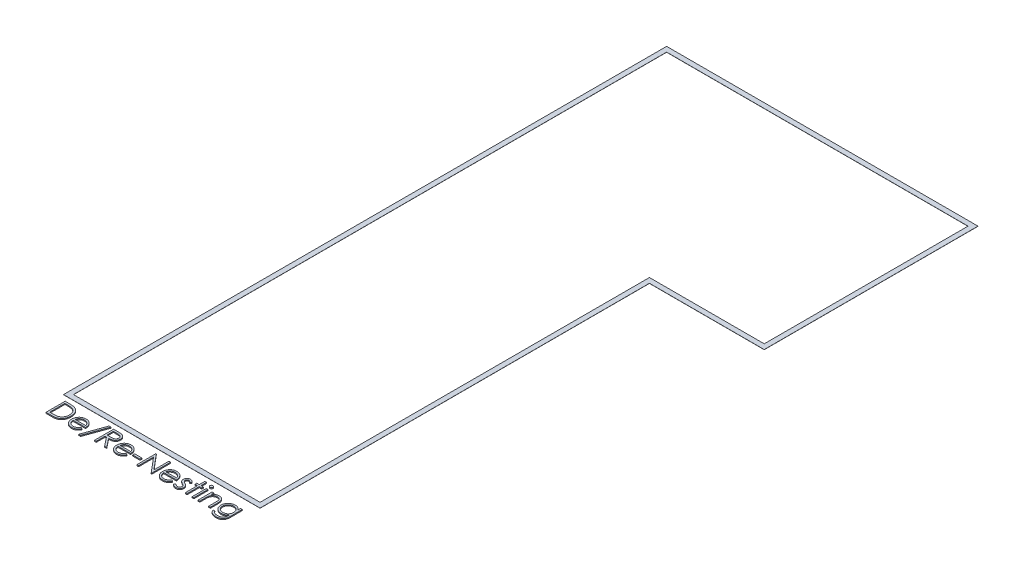
from build123d import *

# Parameters (mm, degrees)
BOSS_EXTRUDE1_DEPTH    = 0.3
BOSS_EXTRUDE2_DEPTH    = 2
BOSS_EXTRUDE2_2_DEPTH  = 2
BOSS_EXTRUDE2_3_DEPTH  = 2
BOSS_EXTRUDE2_4_DEPTH  = 2
BOSS_EXTRUDE2_5_DEPTH  = 2
SKETCH2_W              = 14.807692308
SKETCH2_H              = 3.948717949
BOSS_EXTRUDE2_6_DEPTH  = 2
BOSS_EXTRUDE2_7_DEPTH  = 2
BOSS_EXTRUDE2_8_DEPTH  = 2
BOSS_EXTRUDE2_9_DEPTH  = 2
BOSS_EXTRUDE2_10_DEPTH = 2
BOSS_EXTRUDE2_11_DEPTH = 2
SKETCH2_W_2            = 3.455128205
SKETCH2_H_2            = 28.134615384
BOSS_EXTRUDE2_12_DEPTH = 2
BOSS_EXTRUDE2_13_DEPTH = 2
BOSS_EXTRUDE2_14_DEPTH = 2


with BuildPart() as part:
    # Sketch1 → Boss-Extrude1 (new body)
    with BuildSketch(Plane(origin=(0, 0, 0), x_dir=(1, 0, 0), z_dir=(0, 1, 0))):
        Polygon((-312.025477323, 605.165510167), (-312.025477323, -604.834489833), (82.380342564, -604.834489833), (82.380342564, 176.302523591), (312.68751799, 176.302523591), (312.68751799, 605.165510167), align=None)
        Polygon((-302.025477323, 595.165510167), (-302.025477323, -594.834489833), (72.380342564, -594.834489833), (72.380342564, 186.302523591), (302.68751799, 186.302523591), (302.68751799, 595.165510167), align=None, mode=Mode.SUBTRACT)
    extrude(amount=BOSS_EXTRUDE1_DEPTH)


with BuildPart() as body_2:
    # Sketch2 → Boss-Extrude2 (new body)
    with BuildSketch(Plane(origin=(0, 0, 0), x_dir=(1, 0, 0), z_dir=(0, 1, 0))):
        with BuildLine():
            Line((-297.089579887, -654.834489833), (-297.089579887, -616.334489833))
            Line((-297.089579887, -616.334489833), (-289.315541426, -616.334489833))
            add(Edge.make_bspline(
                [(-289.315541426, -616.334489833), (-288.639382556, -616.339358103), (-287.333047137, -616.348763576), (-285.445310215, -616.408398878), (-283.698688828, -616.513894002), (-282.098927378, -616.66755879), (-280.641634046, -616.85624216), (-279.330889357, -617.092746608), (-278.159915785, -617.372016482), (-277.439751939, -617.610116434), (-277.099195272, -617.722710987)],
                knots=[0, 0, 0, 0, 1.314313732, 2.53924729, 3.670748893, 4.714932338, 5.66265055, 6.526160246, 7.303039223, 8, 8, 8, 8], degree=3))
            add(Edge.make_bspline(
                [(-277.099195272, -617.722710987), (-276.65375314, -617.892448749), (-275.772970024, -618.228075184), (-274.518891676, -618.861194499), (-273.338312684, -619.578538618), (-272.22490209, -620.381053108), (-271.204093, -621.291460941), (-270.236006135, -622.271088883), (-269.360244174, -623.355560625), (-268.558252917, -624.522385493), (-267.835160663, -625.757818067), (-267.206629927, -627.059504263), (-266.684636, -628.420833552), (-266.251310508, -629.83802018), (-265.909799475, -631.314180336), (-265.676798226, -632.851032862), (-265.523117337, -634.442503946), (-265.507672773, -635.522423047), (-265.499836298, -636.070367237)],
                knots=[0, 0, 0, 0, 0.984719456, 1.947108742, 2.898477687, 3.838006223, 4.779231079, 5.722358779, 6.681677486, 7.655904652, 8.64651281, 9.637519902, 10.640069247, 11.656948941, 12.698408672, 13.768548281, 14.867775369, 16, 16, 16, 16], degree=3))
            add(Edge.make_bspline(
                [(-265.499836298, -636.070367237), (-265.50675494, -636.546240861), (-265.520388847, -637.483999539), (-265.642811322, -638.866049391), (-265.820750842, -640.207098675), (-266.096237018, -641.500761376), (-266.430664666, -642.758371773), (-266.85927033, -643.96652646), (-267.350260788, -645.136308363), (-267.922809453, -646.251900598), (-268.551364688, -647.308817694), (-269.225903863, -648.305148503), (-269.945707512, -649.226675943), (-270.717639474, -650.076190675), (-271.531724355, -650.852412038), (-272.393291991, -651.561824207), (-273.30456555, -652.19054631), (-274.2614635, -652.7632845), (-275.291900921, -653.262908411), (-276.415395449, -653.685638519), (-277.636738407, -654.035951288), (-278.952931933, -654.328231142), (-280.366250189, -654.560081471), (-281.878078813, -654.715471788), (-283.486094999, -654.820554047), (-284.590266917, -654.829754374), (-285.158590304, -654.834489833)],
                knots=[0, 0, 0, 0, 1.105936401, 2.179363191, 3.223086493, 4.248585256, 5.251745608, 6.245858792, 7.225916811, 8.198733463, 9.158002045, 10.082870192, 10.993790845, 11.873723703, 12.748670949, 13.606408763, 14.465103618, 15.319838547, 16.196477973, 17.123216899, 18.106603292, 19.147568657, 20.255746949, 21.433717677, 22.679120308, 24, 24, 24, 24], degree=3))
            Line((-285.158590304, -654.834489833), (-297.089579887, -654.834489833))
        make_face()
        with BuildLine():
            Line((-293.634451682, -650.885771885), (-289.215281009, -650.885771885))
            add(Edge.make_bspline(
                [(-289.215281009, -650.885771885), (-288.580268931, -650.883042825), (-287.358908148, -650.877793842), (-285.602670178, -650.831734608), (-283.997996817, -650.756473295), (-282.544660214, -650.65114744), (-281.243480947, -650.511792673), (-280.091739698, -650.356418742), (-279.093211856, -650.162846784), (-278.48898805, -649.98738623), (-278.209772195, -649.906304737)],
                knots=[0, 0, 0, 0, 1.375205317, 2.645023457, 3.804390687, 4.853969522, 5.800190428, 6.637939096, 7.370582563, 8, 8, 8, 8], degree=3))
            add(Edge.make_bspline(
                [(-278.209772195, -649.906304737), (-277.858340212, -649.782537597), (-277.163870192, -649.537959491), (-276.164178255, -649.091825218), (-275.231851204, -648.56336245), (-274.350640926, -647.975937437), (-273.533047716, -647.308831414), (-272.769382436, -646.576550538), (-272.061182621, -645.775368012), (-271.415765234, -644.906278235), (-270.838173889, -643.974690483), (-270.337990366, -642.989763312), (-269.899623518, -641.9622884), (-269.555558999, -640.876487655), (-269.285887574, -639.742068012), (-269.094876006, -638.558949666), (-268.975914037, -637.327353566), (-268.96203811, -636.489680199), (-268.954964503, -636.062654897)],
                knots=[0, 0, 0, 0, 0.998632004, 1.973411704, 2.929992603, 3.868527914, 4.809262121, 5.754881198, 6.702106254, 7.672490631, 8.653608572, 9.636854334, 10.631411391, 11.644891563, 12.686317036, 13.754757253, 14.855430412, 16, 16, 16, 16], degree=3))
            add(Edge.make_bspline(
                [(-268.954964503, -636.062654897), (-268.960610664, -635.612386614), (-268.971702597, -634.727830586), (-269.111120012, -633.429932938), (-269.314857122, -632.181645782), (-269.609477669, -630.982885633), (-269.984917336, -629.831313759), (-270.453458395, -628.733299147), (-270.988791207, -627.677245589), (-271.625727912, -626.687527566), (-272.323299439, -625.751503366), (-273.097456112, -624.893999294), (-273.935898536, -624.113061991), (-274.82948188, -623.396529552), (-275.803389972, -622.773229117), (-276.83468057, -622.215675625), (-277.938482953, -621.742500821), (-278.706422608, -621.49083333), (-279.096691266, -621.362935346)],
                knots=[0, 0, 0, 0, 1.122418816, 2.205001699, 3.251619955, 4.274784885, 5.280384055, 6.268708349, 7.249350384, 8.229342522, 9.199999885, 10.157847722, 11.105861043, 12.055065948, 13.010012805, 13.98527497, 14.976112212, 16, 16, 16, 16], degree=3))
            add(Edge.make_bspline(
                [(-279.096691266, -621.362935346), (-279.419553876, -621.27365464), (-280.106048369, -621.083819361), (-281.226282473, -620.876740264), (-282.487049117, -620.694090774), (-283.893945829, -620.539452342), (-285.445368879, -620.428491807), (-287.142511447, -620.345207346), (-288.986107097, -620.289034389), (-290.26411497, -620.28519861), (-290.927420432, -620.283207782)],
                knots=[0, 0, 0, 0, 0.674548936, 1.434276114, 2.292660221, 3.240891867, 4.284742987, 5.42552168, 6.663806718, 8, 8, 8, 8], degree=3))
            Line((-290.927420432, -620.283207782), (-293.634451682, -620.283207782))
            Line((-293.634451682, -620.283207782), (-293.634451682, -650.885771885))
        make_face(mode=Mode.SUBTRACT)
    extrude(amount=BOSS_EXTRUDE2_DEPTH)


with BuildPart() as body_3:
    # Sketch2 → Boss-Extrude2 2 (new body)
    with BuildSketch(Plane(origin=(0, 0, 0), x_dir=(1, 0, 0), z_dir=(0, 1, 0))):
        with BuildLine():
            Line((-235.498834695, -645.949874449), (-232.429323477, -647.561753455))
            add(Edge.make_bspline(
                [(-232.429323477, -647.561753455), (-232.673926025, -647.995630099), (-233.149825718, -648.83978223), (-233.968233945, -649.999532695), (-234.826146743, -651.04285757), (-235.762290391, -651.941883767), (-236.74865686, -652.725649001), (-237.790716062, -653.411365073), (-238.893893058, -653.995668797), (-240.05824003, -654.487946604), (-241.293535093, -654.866451039), (-242.602771773, -655.133797469), (-243.988458222, -655.299053424), (-244.938266201, -655.318249973), (-245.424615945, -655.328079577)],
                knots=[0, 0, 0, 0, 1.120438281, 2.179929193, 3.190490725, 4.156257408, 5.095198341, 6.022838206, 6.959905092, 7.901321166, 8.864066838, 9.862729781, 10.905609505, 12, 12, 12, 12], degree=3))
            add(Edge.make_bspline(
                [(-245.424615945, -655.328079577), (-245.965177698, -655.315460648), (-247.019657076, -655.290844774), (-248.554594294, -655.078627666), (-249.999767897, -654.73243172), (-251.355096634, -654.248810763), (-252.617261412, -653.617110198), (-253.788770815, -652.847555899), (-254.8757856, -651.944101097), (-255.844051901, -650.898920219), (-256.71573461, -649.780418688), (-257.48491863, -648.614903959), (-258.127950372, -647.40530849), (-258.651029084, -646.159332725), (-259.073482598, -644.884829896), (-259.36791634, -643.570203753), (-259.537643568, -642.219012327), (-259.563652469, -641.304941634), (-259.576759375, -640.844305538)],
                knots=[0, 0, 0, 0, 1.145258523, 2.234067595, 3.276747158, 4.290159414, 5.277019952, 6.260822364, 7.254936242, 8.264827045, 9.274100331, 10.257902744, 11.220704747, 12.172965371, 13.118907548, 14.062713208, 15.023725156, 16, 16, 16, 16], degree=3))
            add(Edge.make_bspline(
                [(-259.576759375, -640.844305538), (-259.56510882, -640.412062404), (-259.542018959, -639.555413592), (-259.396480298, -638.287492603), (-259.138549074, -637.055179625), (-258.784609511, -635.857450697), (-258.327545803, -634.696311223), (-257.768391391, -633.571054523), (-257.106275236, -632.482877985), (-256.595075824, -631.796443514), (-256.337576682, -631.450675731)],
                knots=[0, 0, 0, 0, 1.024358464, 2.0301432, 3.019427413, 4.004406732, 4.986367066, 5.972626655, 6.978780325, 8, 8, 8, 8], degree=3))
            add(Edge.make_bspline(
                [(-256.337576682, -631.450675731), (-255.988792172, -631.03411816), (-255.302271759, -630.214198505), (-254.14115185, -629.136876921), (-252.88384969, -628.234395394), (-251.546121803, -627.486316897), (-250.112420589, -626.91790678), (-248.602018387, -626.494323375), (-246.997716939, -626.256965254), (-245.900959509, -626.223439084), (-245.339780208, -626.206284705)],
                knots=[0, 0, 0, 0, 1.030682036, 2.02871468, 2.997146059, 3.962720338, 4.930598197, 5.918074684, 6.934738563, 8, 8, 8, 8], degree=3))
            add(Edge.make_bspline(
                [(-245.339780208, -626.206284705), (-244.76285655, -626.221179243), (-243.631063844, -626.250398931), (-241.980710513, -626.521288598), (-240.419142631, -626.950866699), (-238.946985083, -627.557558394), (-237.564088615, -628.340313464), (-236.27944207, -629.30987372), (-235.071075432, -630.43647268), (-234.368081064, -631.302867983), (-234.010353125, -631.743744641)],
                knots=[0, 0, 0, 0, 1.056321875, 2.072262726, 3.055038591, 4.01806755, 4.982017516, 5.957941055, 6.960871419, 8, 8, 8, 8], degree=3))
            add(Edge.make_bspline(
                [(-234.010353125, -631.743744641), (-233.766956803, -632.075984036), (-233.281784279, -632.738251342), (-232.674066179, -633.81813407), (-232.146534834, -634.947950608), (-231.724872263, -636.145963876), (-231.38343775, -637.397979258), (-231.136412743, -638.71294725), (-230.991546939, -640.090476275), (-230.963071268, -641.029068385), (-230.948554246, -641.507566756)],
                knots=[0, 0, 0, 0, 0.94817472, 1.890038105, 2.849395472, 3.817997239, 4.812318967, 5.836947057, 6.897266129, 8, 8, 8, 8], degree=3))
            Line((-230.948554246, -641.507566756), (-256.121631169, -641.507566756))
            add(Edge.make_bspline(
                [(-256.121631169, -641.507566756), (-256.104695499, -641.878271863), (-256.071392185, -642.607248504), (-255.91612561, -643.673927118), (-255.671389099, -644.690033882), (-255.32742941, -645.647947344), (-254.910894112, -646.560178746), (-254.400651227, -647.419961153), (-253.791916134, -648.223378384), (-253.112933441, -648.977616897), (-252.357155392, -649.64928527), (-251.562045173, -650.250454809), (-250.716215958, -650.754316373), (-249.826337039, -651.16329516), (-248.893847403, -651.483464637), (-247.918453256, -651.702010664), (-246.902073977, -651.84838884), (-246.209230902, -651.864665157), (-245.856506971, -651.872951372)],
                knots=[0, 0, 0, 0, 1.094153842, 2.151609401, 3.174256925, 4.172055639, 5.149267565, 6.128595816, 7.11444997, 8.118368179, 9.117203808, 10.09244225, 11.054858984, 12.015122123, 12.976791628, 13.957293641, 14.960065497, 16, 16, 16, 16], degree=3))
            add(Edge.make_bspline(
                [(-245.856506971, -651.872951372), (-245.511644347, -651.866262749), (-244.827370747, -651.852991237), (-243.808321316, -651.723940217), (-242.805786515, -651.515267185), (-241.823915699, -651.230477294), (-240.882636394, -650.883131921), (-240.010935343, -650.464000487), (-239.209252971, -650.000353273), (-238.459966339, -649.470046847), (-237.733185412, -648.82095679), (-237.012218061, -648.010963859), (-236.239174874, -647.053001054), (-235.755289354, -646.331998728), (-235.498834695, -645.949874449)],
                knots=[0, 0, 0, 0, 0.99110716, 1.966546729, 2.947904876, 3.932708344, 4.903319531, 5.828989031, 6.710028674, 7.56322171, 8.463672341, 9.504779593, 10.677557249, 12, 12, 12, 12], degree=3))
        make_face()
        with BuildLine():
            add(Edge.make_bspline(
                [(-234.403682451, -638.052438551), (-234.530145322, -637.59414694), (-234.773545638, -636.712083114), (-235.282145647, -635.490633319), (-235.854932594, -634.405066408), (-236.53277164, -633.463690444), (-237.300777621, -632.627651802), (-238.187874631, -631.897047365), (-239.182669459, -631.243455403), (-240.280020006, -630.691777909), (-241.442079642, -630.222189463), (-242.658747754, -629.90731319), (-243.900183421, -629.691608224), (-244.73986057, -629.671521032), (-245.162396394, -629.66141291)],
                knots=[0, 0, 0, 0, 1.154881502, 2.222775134, 3.210006277, 4.132804581, 5.035138423, 5.962687519, 6.919655026, 7.923214229, 8.944639381, 9.960483929, 10.97369054, 12, 12, 12, 12], degree=3))
            add(Edge.make_bspline(
                [(-245.162396394, -629.66141291), (-245.507240217, -629.668141297), (-246.188923957, -629.681441904), (-247.193235707, -629.807613326), (-248.157712395, -630.01617162), (-249.089470559, -630.301786143), (-249.976300111, -630.68248077), (-250.836442561, -631.128896263), (-251.64802692, -631.673853685), (-252.15558117, -632.089201088), (-252.411995753, -632.299033103)],
                knots=[0, 0, 0, 0, 1.04873581, 2.073130211, 3.073294108, 4.04793562, 5.032784715, 6.005352987, 6.992311501, 8, 8, 8, 8], degree=3))
            add(Edge.make_bspline(
                [(-252.411995753, -632.299033103), (-252.595621854, -632.465070574), (-252.967236331, -632.801089951), (-253.463782067, -633.380011223), (-253.939207267, -634.004278407), (-254.371877447, -634.697774777), (-254.768730898, -635.452603347), (-255.140090647, -636.262397334), (-255.47434118, -637.133301767), (-255.66239839, -637.740198599), (-255.759151201, -638.052438551)],
                knots=[0, 0, 0, 0, 0.879870761, 1.780643979, 2.707998968, 3.669668524, 4.684282772, 5.740141944, 6.837334558, 8, 8, 8, 8], degree=3))
            Line((-255.759151201, -638.052438551), (-234.403682451, -638.052438551))
        make_face(mode=Mode.SUBTRACT)
    extrude(amount=BOSS_EXTRUDE2_2_DEPTH)


with BuildPart() as body_4:
    # Sketch2 → Boss-Extrude2 3 (new body)
    with BuildSketch(Plane(origin=(0, 0, 0), x_dir=(1, 0, 0), z_dir=(0, 1, 0))):
        Polygon((-206.269067067, -615.347310346), (-222.372432451, -660.263977013), (-226.01265681, -660.263977013), (-209.909291426, -615.347310346), align=None)
    extrude(amount=BOSS_EXTRUDE2_3_DEPTH)


with BuildPart() as body_5:
    # Sketch2 → Boss-Extrude2 4 (new body)
    with BuildSketch(Plane(origin=(0, 0, 0), x_dir=(1, 0, 0), z_dir=(0, 1, 0))):
        with BuildLine():
            Line((-199.8524004, -616.334489833), (-192.147772996, -616.334489833))
            add(Edge.make_bspline(
                [(-192.147772996, -616.334489833), (-191.633620583, -616.336201279), (-190.646390994, -616.339487445), (-189.23208502, -616.357810837), (-187.946986953, -616.41032875), (-186.791768721, -616.455523168), (-185.766451516, -616.537934522), (-184.867891318, -616.616701641), (-184.100226645, -616.719811909), (-183.635522281, -616.815571562), (-183.425116746, -616.858928936)],
                knots=[0, 0, 0, 0, 1.410062039, 2.707475311, 3.878576406, 4.937260626, 5.877586885, 6.699081471, 7.410979367, 8, 8, 8, 8], degree=3))
            add(Edge.make_bspline(
                [(-183.425116746, -616.858928936), (-183.143443881, -616.928523355), (-182.586106997, -617.066227555), (-181.78365627, -617.357283164), (-181.018998707, -617.694099035), (-180.295310639, -618.089699959), (-179.616216936, -618.547022535), (-178.974715517, -619.058171882), (-178.36789542, -619.620351145), (-177.820297488, -620.247734402), (-177.30396792, -620.905936008), (-176.868493028, -621.617677333), (-176.493101751, -622.361954136), (-176.194226064, -623.146335732), (-175.953568356, -623.963215222), (-175.783879723, -624.819991986), (-175.682116659, -625.712762712), (-175.671756248, -626.321699709), (-175.666502964, -626.630463391)],
                knots=[0, 0, 0, 0, 1.027469482, 2.033020251, 3.019912614, 3.986113645, 4.951240523, 5.91722682, 6.890402269, 7.87763091, 8.8651537, 9.85103654, 10.82876324, 11.815024772, 12.821070561, 13.842952187, 14.906261191, 16, 16, 16, 16], degree=3))
            add(Edge.make_bspline(
                [(-175.666502964, -626.630463391), (-175.682661943, -627.143449542), (-175.714192297, -628.144418389), (-176.008168438, -629.597088084), (-176.489710155, -630.952170545), (-177.153266334, -632.207959562), (-177.998280567, -633.339976661), (-179.013853269, -634.334271669), (-180.200550995, -635.166310708), (-181.30527347, -635.74329156), (-182.281129667, -636.112813555), (-183.084496108, -636.372813502), (-183.96083286, -636.57369512), (-184.901743541, -636.75365657), (-185.911143751, -636.889525208), (-186.986614185, -636.989037747), (-188.128921853, -637.051232283), (-188.913651615, -637.060494337), (-189.31734431, -637.065259064)],
                knots=[0, 0, 0, 0, 1.260483769, 2.459530307, 3.627416485, 4.787058657, 5.939039949, 7.08810263, 8.267026773, 9.491475466, 10.141966685, 10.831826277, 11.566392101, 12.351337768, 13.187381173, 14.07005841, 15.007169909, 16, 16, 16, 16], degree=3))
            Line((-189.31734431, -637.065259064), (-175.172913221, -654.834489833))
            Line((-175.172913221, -654.834489833), (-179.445549439, -654.834489833))
            Line((-179.445549439, -654.834489833), (-193.589980528, -637.065259064))
            Line((-193.589980528, -637.065259064), (-196.397272195, -637.065259064))
            Line((-196.397272195, -637.065259064), (-196.397272195, -654.834489833))
            Line((-196.397272195, -654.834489833), (-199.8524004, -654.834489833))
            Line((-199.8524004, -654.834489833), (-199.8524004, -616.334489833))
        make_face()
        with BuildLine():
            Line((-196.397272195, -620.283207782), (-196.397272195, -633.116541115))
            Line((-196.397272195, -633.116541115), (-189.348193669, -633.170527494))
            add(Edge.make_bspline(
                [(-189.348193669, -633.170527494), (-189.019073241, -633.170673097), (-188.381144113, -633.170955317), (-187.4582368, -633.127023779), (-186.598915571, -633.077047278), (-185.806467298, -633.000604477), (-185.080537969, -632.902087688), (-184.421490424, -632.778854861), (-183.828248853, -632.635282172), (-183.13636493, -632.413064288), (-182.363763085, -632.060998087), (-181.524117027, -631.548777602), (-180.809091311, -630.904517291), (-180.204994826, -630.167809275), (-179.71957108, -629.357810537), (-179.377338482, -628.484230476), (-179.160171617, -627.569122898), (-179.134557617, -626.940163712), (-179.121631169, -626.622751051)],
                knots=[0, 0, 0, 0, 1.146690395, 2.22261258, 3.21895312, 4.145990853, 4.996080663, 5.770904154, 6.481378293, 7.121626537, 8.300444488, 9.431385265, 10.535395872, 11.636531494, 12.74115979, 13.810798291, 14.895190096, 16, 16, 16, 16], degree=3))
            add(Edge.make_bspline(
                [(-179.121631169, -626.622751051), (-179.134854501, -626.31313874), (-179.16105832, -625.699600115), (-179.374994774, -624.801385102), (-179.736777969, -623.95364865), (-180.224322586, -623.159839315), (-180.818313291, -622.439276221), (-181.51480923, -621.822757537), (-182.294766377, -621.314013426), (-183.023749559, -620.98891524), (-183.675325896, -620.789596854), (-184.241052157, -620.649334053), (-184.880278412, -620.536644894), (-185.596108456, -620.446356225), (-186.385486395, -620.368751838), (-187.252403557, -620.316482273), (-188.19110814, -620.285529768), (-188.841724383, -620.28399979), (-189.178522195, -620.283207782)],
                knots=[0, 0, 0, 0, 1.101028733, 2.181837193, 3.264309656, 4.369019818, 5.486613113, 6.575447106, 7.666700264, 8.788928104, 9.402425223, 10.0903467, 10.862060571, 11.710948788, 12.657782767, 13.684531032, 14.801375019, 16, 16, 16, 16], degree=3))
            Line((-189.178522195, -620.283207782), (-196.397272195, -620.283207782))
        make_face(mode=Mode.SUBTRACT)
    extrude(amount=BOSS_EXTRUDE2_4_DEPTH)


with BuildPart() as body_6:
    # Sketch2 → Boss-Extrude2 5 (new body)
    with BuildSketch(Plane(origin=(0, 0, 0), x_dir=(1, 0, 0), z_dir=(0, 1, 0))):
        with BuildLine():
            Line((-145.171911618, -645.949874449), (-142.1024004, -647.561753455))
            add(Edge.make_bspline(
                [(-142.1024004, -647.561753455), (-142.347002948, -647.995630099), (-142.822902641, -648.83978223), (-143.641310868, -649.999532695), (-144.499223666, -651.04285757), (-145.435367314, -651.941883767), (-146.421733783, -652.725649001), (-147.463792986, -653.411365073), (-148.566969981, -653.995668797), (-149.731316953, -654.487946604), (-150.966612016, -654.866451039), (-152.275848696, -655.133797469), (-153.661535145, -655.299053424), (-154.611343124, -655.318249973), (-155.097692868, -655.328079577)],
                knots=[0, 0, 0, 0, 1.120438281, 2.179929193, 3.190490725, 4.156257408, 5.095198341, 6.022838206, 6.959905092, 7.901321166, 8.864066838, 9.862729781, 10.905609505, 12, 12, 12, 12], degree=3))
            add(Edge.make_bspline(
                [(-155.097692868, -655.328079577), (-155.638254621, -655.315460648), (-156.692733999, -655.290844774), (-158.227671218, -655.078627666), (-159.67284482, -654.73243172), (-161.028173557, -654.248810763), (-162.290338335, -653.617110198), (-163.461847738, -652.847555899), (-164.548862523, -651.944101097), (-165.517128824, -650.898920219), (-166.388811533, -649.780418688), (-167.157995553, -648.614903959), (-167.801027295, -647.40530849), (-168.324106007, -646.159332725), (-168.746559522, -644.884829896), (-169.040993263, -643.570203753), (-169.210720491, -642.219012327), (-169.236729392, -641.304941634), (-169.249836298, -640.844305538)],
                knots=[0, 0, 0, 0, 1.145258523, 2.234067595, 3.276747158, 4.290159414, 5.277019952, 6.260822364, 7.254936242, 8.264827045, 9.274100331, 10.257902744, 11.220704747, 12.172965371, 13.118907548, 14.062713208, 15.023725156, 16, 16, 16, 16], degree=3))
            add(Edge.make_bspline(
                [(-169.249836298, -640.844305538), (-169.238185743, -640.412062404), (-169.215095882, -639.555413592), (-169.069557221, -638.287492603), (-168.811625997, -637.055179625), (-168.457686434, -635.857450697), (-168.000622726, -634.696311223), (-167.441468314, -633.571054523), (-166.779352159, -632.482877985), (-166.268152747, -631.796443514), (-166.010653605, -631.450675731)],
                knots=[0, 0, 0, 0, 1.024358464, 2.0301432, 3.019427413, 4.004406732, 4.986367066, 5.972626655, 6.978780325, 8, 8, 8, 8], degree=3))
            add(Edge.make_bspline(
                [(-166.010653605, -631.450675731), (-165.661869095, -631.03411816), (-164.975348682, -630.214198505), (-163.814228773, -629.136876921), (-162.556926613, -628.234395394), (-161.219198726, -627.486316897), (-159.785497512, -626.91790678), (-158.27509531, -626.494323375), (-156.670793862, -626.256965254), (-155.574036433, -626.223439084), (-155.012857131, -626.206284705)],
                knots=[0, 0, 0, 0, 1.030682036, 2.02871468, 2.997146059, 3.962720338, 4.930598197, 5.918074684, 6.934738563, 8, 8, 8, 8], degree=3))
            add(Edge.make_bspline(
                [(-155.012857131, -626.206284705), (-154.435933473, -626.221179243), (-153.304140767, -626.250398931), (-151.653787436, -626.521288598), (-150.092219554, -626.950866699), (-148.620062007, -627.557558394), (-147.237165538, -628.340313464), (-145.952518993, -629.30987372), (-144.744152355, -630.43647268), (-144.041157988, -631.302867983), (-143.683430048, -631.743744641)],
                knots=[0, 0, 0, 0, 1.056321875, 2.072262726, 3.055038591, 4.01806755, 4.982017516, 5.957941055, 6.960871419, 8, 8, 8, 8], degree=3))
            add(Edge.make_bspline(
                [(-143.683430048, -631.743744641), (-143.440033726, -632.075984036), (-142.954861202, -632.738251342), (-142.347143102, -633.81813407), (-141.819611757, -634.947950608), (-141.397949186, -636.145963876), (-141.056514673, -637.397979258), (-140.809489666, -638.71294725), (-140.664623862, -640.090476275), (-140.636148191, -641.029068385), (-140.621631169, -641.507566756)],
                knots=[0, 0, 0, 0, 0.94817472, 1.890038105, 2.849395472, 3.817997239, 4.812318967, 5.836947057, 6.897266129, 8, 8, 8, 8], degree=3))
            Line((-140.621631169, -641.507566756), (-165.794708093, -641.507566756))
            add(Edge.make_bspline(
                [(-165.794708093, -641.507566756), (-165.777772422, -641.878271863), (-165.744469108, -642.607248504), (-165.589202534, -643.673927118), (-165.344466022, -644.690033882), (-165.000506333, -645.647947344), (-164.583971035, -646.560178746), (-164.073728151, -647.419961153), (-163.464993057, -648.223378384), (-162.786010364, -648.977616897), (-162.030232315, -649.64928527), (-161.235122096, -650.250454809), (-160.389292881, -650.754316373), (-159.499413962, -651.16329516), (-158.566924326, -651.483464637), (-157.59153018, -651.702010664), (-156.5751509, -651.84838884), (-155.882307825, -651.864665157), (-155.529583894, -651.872951372)],
                knots=[0, 0, 0, 0, 1.094153842, 2.151609401, 3.174256925, 4.172055639, 5.149267565, 6.128595816, 7.11444997, 8.118368179, 9.117203808, 10.09244225, 11.054858984, 12.015122123, 12.976791628, 13.957293641, 14.960065497, 16, 16, 16, 16], degree=3))
            add(Edge.make_bspline(
                [(-155.529583894, -651.872951372), (-155.18472127, -651.866262749), (-154.50044767, -651.852991237), (-153.481398239, -651.723940217), (-152.478863438, -651.515267185), (-151.496992622, -651.230477294), (-150.555713317, -650.883131921), (-149.684012266, -650.464000487), (-148.882329894, -650.000353273), (-148.133043262, -649.470046847), (-147.406262335, -648.82095679), (-146.685294984, -648.010963859), (-145.912251797, -647.053001054), (-145.428366277, -646.331998728), (-145.171911618, -645.949874449)],
                knots=[0, 0, 0, 0, 0.99110716, 1.966546729, 2.947904876, 3.932708344, 4.903319531, 5.828989031, 6.710028674, 7.56322171, 8.463672341, 9.504779593, 10.677557249, 12, 12, 12, 12], degree=3))
        make_face()
        with BuildLine():
            add(Edge.make_bspline(
                [(-144.076759375, -638.052438551), (-144.203222245, -637.59414694), (-144.446622561, -636.712083114), (-144.95522257, -635.490633319), (-145.528009518, -634.405066408), (-146.205848563, -633.463690444), (-146.973854545, -632.627651802), (-147.860951554, -631.897047365), (-148.855746382, -631.243455403), (-149.95309693, -630.691777909), (-151.115156565, -630.222189463), (-152.331824677, -629.90731319), (-153.573260344, -629.691608224), (-154.412937493, -629.671521032), (-154.835473317, -629.66141291)],
                knots=[0, 0, 0, 0, 1.154881502, 2.222775134, 3.210006277, 4.132804581, 5.035138423, 5.962687519, 6.919655026, 7.923214229, 8.944639381, 9.960483929, 10.97369054, 12, 12, 12, 12], degree=3))
            add(Edge.make_bspline(
                [(-154.835473317, -629.66141291), (-155.180317141, -629.668141297), (-155.86200088, -629.681441904), (-156.86631263, -629.807613326), (-157.830789318, -630.01617162), (-158.762547482, -630.301786143), (-159.649377034, -630.68248077), (-160.509519485, -631.128896263), (-161.321103843, -631.673853685), (-161.828658094, -632.089201088), (-162.085072676, -632.299033103)],
                knots=[0, 0, 0, 0, 1.04873581, 2.073130211, 3.073294108, 4.04793562, 5.032784715, 6.005352987, 6.992311501, 8, 8, 8, 8], degree=3))
            add(Edge.make_bspline(
                [(-162.085072676, -632.299033103), (-162.268698777, -632.465070574), (-162.640313254, -632.801089951), (-163.13685899, -633.380011223), (-163.61228419, -634.004278407), (-164.04495437, -634.697774777), (-164.441807821, -635.452603347), (-164.81316757, -636.262397334), (-165.147418103, -637.133301767), (-165.335475313, -637.740198599), (-165.432228125, -638.052438551)],
                knots=[0, 0, 0, 0, 0.879870761, 1.780643979, 2.707998968, 3.669668524, 4.684282772, 5.740141944, 6.837334558, 8, 8, 8, 8], degree=3))
            Line((-165.432228125, -638.052438551), (-144.076759375, -638.052438551))
        make_face(mode=Mode.SUBTRACT)
    extrude(amount=BOSS_EXTRUDE2_5_DEPTH)


with BuildPart() as body_7:
    # Sketch2 → Boss-Extrude2 6 (new body)
    with BuildSketch(Plane(origin=(0, 0, 0), x_dir=(1, 0, 0), z_dir=(0, 1, 0))):
        with Locations((-128.775477323, -640.026797526)):
            Rectangle(SKETCH2_W, SKETCH2_H)
    extrude(amount=BOSS_EXTRUDE2_6_DEPTH)


with BuildPart() as body_8:
    # Sketch2 → Boss-Extrude2 7 (new body)
    with BuildSketch(Plane(origin=(0, 0, 0), x_dir=(1, 0, 0), z_dir=(0, 1, 0))):
        Polygon((-114.954964503, -654.834489833), (-114.954964503, -616.334489833), (-114.230004567, -616.334489833), (-88.794708093, -646.636272686), (-88.794708093, -616.334489833), (-85.339579887, -616.334489833), (-85.339579887, -654.834489833), (-86.126238541, -654.834489833), (-111.499836298, -624.602118038), (-111.499836298, -654.834489833), align=None)
    extrude(amount=BOSS_EXTRUDE2_7_DEPTH)


with BuildPart() as body_9:
    # Sketch2 → Boss-Extrude2 8 (new body)
    with BuildSketch(Plane(origin=(0, 0, 0), x_dir=(1, 0, 0), z_dir=(0, 1, 0))):
        with BuildLine():
            Line((-53.36421931, -645.949874449), (-50.294708093, -647.561753455))
            add(Edge.make_bspline(
                [(-50.294708093, -647.561753455), (-50.53931064, -647.995630099), (-51.015210333, -648.83978223), (-51.83361856, -649.999532695), (-52.691531359, -651.04285757), (-53.627675007, -651.941883767), (-54.614041475, -652.725649001), (-55.656100678, -653.411365073), (-56.759277673, -653.995668797), (-57.923624645, -654.487946604), (-59.158919708, -654.866451039), (-60.468156389, -655.133797469), (-61.853842838, -655.299053424), (-62.803650816, -655.318249973), (-63.29000056, -655.328079577)],
                knots=[0, 0, 0, 0, 1.120438281, 2.179929193, 3.190490725, 4.156257408, 5.095198341, 6.022838206, 6.959905092, 7.901321166, 8.864066838, 9.862729781, 10.905609505, 12, 12, 12, 12], degree=3))
            add(Edge.make_bspline(
                [(-63.29000056, -655.328079577), (-63.830562313, -655.315460648), (-64.885041692, -655.290844774), (-66.41997891, -655.078627666), (-67.865152512, -654.73243172), (-69.220481249, -654.248810763), (-70.482646027, -653.617110198), (-71.65415543, -652.847555899), (-72.741170215, -651.944101097), (-73.709436516, -650.898920219), (-74.581119226, -649.780418688), (-75.350303246, -648.614903959), (-75.993334987, -647.40530849), (-76.516413699, -646.159332725), (-76.938867214, -644.884829896), (-77.233300955, -643.570203753), (-77.403028183, -642.219012327), (-77.429037084, -641.304941634), (-77.44214399, -640.844305538)],
                knots=[0, 0, 0, 0, 1.145258523, 2.234067595, 3.276747158, 4.290159414, 5.277019952, 6.260822364, 7.254936242, 8.264827045, 9.274100331, 10.257902744, 11.220704747, 12.172965371, 13.118907548, 14.062713208, 15.023725156, 16, 16, 16, 16], degree=3))
            add(Edge.make_bspline(
                [(-77.44214399, -640.844305538), (-77.430493435, -640.412062404), (-77.407403575, -639.555413592), (-77.261864913, -638.287492603), (-77.003933689, -637.055179625), (-76.649994126, -635.857450697), (-76.192930418, -634.696311223), (-75.633776007, -633.571054523), (-74.971659851, -632.482877985), (-74.46046044, -631.796443514), (-74.202961298, -631.450675731)],
                knots=[0, 0, 0, 0, 1.024358464, 2.0301432, 3.019427413, 4.004406732, 4.986367066, 5.972626655, 6.978780325, 8, 8, 8, 8], degree=3))
            add(Edge.make_bspline(
                [(-74.202961298, -631.450675731), (-73.854176787, -631.03411816), (-73.167656374, -630.214198505), (-72.006536466, -629.136876921), (-70.749234306, -628.234395394), (-69.411506419, -627.486316897), (-67.977805204, -626.91790678), (-66.467403003, -626.494323375), (-64.863101554, -626.256965254), (-63.766344125, -626.223439084), (-63.205164823, -626.206284705)],
                knots=[0, 0, 0, 0, 1.030682036, 2.02871468, 2.997146059, 3.962720338, 4.930598197, 5.918074684, 6.934738563, 8, 8, 8, 8], degree=3))
            add(Edge.make_bspline(
                [(-63.205164823, -626.206284705), (-62.628241165, -626.221179243), (-61.49644846, -626.250398931), (-59.846095128, -626.521288598), (-58.284527246, -626.950866699), (-56.812369699, -627.557558394), (-55.429473231, -628.340313464), (-54.144826685, -629.30987372), (-52.936460047, -630.43647268), (-52.23346568, -631.302867983), (-51.87573774, -631.743744641)],
                knots=[0, 0, 0, 0, 1.056321875, 2.072262726, 3.055038591, 4.01806755, 4.982017516, 5.957941055, 6.960871419, 8, 8, 8, 8], degree=3))
            add(Edge.make_bspline(
                [(-51.87573774, -631.743744641), (-51.632341419, -632.075984036), (-51.147168894, -632.738251342), (-50.539450794, -633.81813407), (-50.011919449, -634.947950608), (-49.590256878, -636.145963876), (-49.248822365, -637.397979258), (-49.001797359, -638.71294725), (-48.856931554, -640.090476275), (-48.828455884, -641.029068385), (-48.813938862, -641.507566756)],
                knots=[0, 0, 0, 0, 0.94817472, 1.890038105, 2.849395472, 3.817997239, 4.812318967, 5.836947057, 6.897266129, 8, 8, 8, 8], degree=3))
            Line((-48.813938862, -641.507566756), (-73.987015785, -641.507566756))
            add(Edge.make_bspline(
                [(-73.987015785, -641.507566756), (-73.970080114, -641.878271863), (-73.936776801, -642.607248504), (-73.781510226, -643.673927118), (-73.536773714, -644.690033882), (-73.192814025, -645.647947344), (-72.776278727, -646.560178746), (-72.266035843, -647.419961153), (-71.657300749, -648.223378384), (-70.978318056, -648.977616897), (-70.222540007, -649.64928527), (-69.427429788, -650.250454809), (-68.581600573, -650.754316373), (-67.691721655, -651.16329516), (-66.759232018, -651.483464637), (-65.783837872, -651.702010664), (-64.767458592, -651.84838884), (-64.074615518, -651.864665157), (-63.721891586, -651.872951372)],
                knots=[0, 0, 0, 0, 1.094153842, 2.151609401, 3.174256925, 4.172055639, 5.149267565, 6.128595816, 7.11444997, 8.118368179, 9.117203808, 10.09244225, 11.054858984, 12.015122123, 12.976791628, 13.957293641, 14.960065497, 16, 16, 16, 16], degree=3))
            add(Edge.make_bspline(
                [(-63.721891586, -651.872951372), (-63.377028962, -651.866262749), (-62.692755362, -651.852991237), (-61.673705931, -651.723940217), (-60.67117113, -651.515267185), (-59.689300314, -651.230477294), (-58.748021009, -650.883131921), (-57.876319958, -650.464000487), (-57.074637587, -650.000353273), (-56.325350954, -649.470046847), (-55.598570027, -648.82095679), (-54.877602677, -648.010963859), (-54.10455949, -647.053001054), (-53.620673969, -646.331998728), (-53.36421931, -645.949874449)],
                knots=[0, 0, 0, 0, 0.99110716, 1.966546729, 2.947904876, 3.932708344, 4.903319531, 5.828989031, 6.710028674, 7.56322171, 8.463672341, 9.504779593, 10.677557249, 12, 12, 12, 12], degree=3))
        make_face()
        with BuildLine():
            add(Edge.make_bspline(
                [(-52.269067067, -638.052438551), (-52.395529937, -637.59414694), (-52.638930253, -636.712083114), (-53.147530262, -635.490633319), (-53.72031721, -634.405066408), (-54.398156255, -633.463690444), (-55.166162237, -632.627651802), (-56.053259246, -631.897047365), (-57.048054074, -631.243455403), (-58.145404622, -630.691777909), (-59.307464258, -630.222189463), (-60.524132369, -629.90731319), (-61.765568036, -629.691608224), (-62.605245186, -629.671521032), (-63.027781009, -629.66141291)],
                knots=[0, 0, 0, 0, 1.154881502, 2.222775134, 3.210006277, 4.132804581, 5.035138423, 5.962687519, 6.919655026, 7.923214229, 8.944639381, 9.960483929, 10.97369054, 12, 12, 12, 12], degree=3))
            add(Edge.make_bspline(
                [(-63.027781009, -629.66141291), (-63.372624833, -629.668141297), (-64.054308572, -629.681441904), (-65.058620323, -629.807613326), (-66.023097011, -630.01617162), (-66.954855174, -630.301786143), (-67.841684726, -630.68248077), (-68.701827177, -631.128896263), (-69.513411536, -631.673853685), (-70.020965786, -632.089201088), (-70.277380368, -632.299033103)],
                knots=[0, 0, 0, 0, 1.04873581, 2.073130211, 3.073294108, 4.04793562, 5.032784715, 6.005352987, 6.992311501, 8, 8, 8, 8], degree=3))
            add(Edge.make_bspline(
                [(-70.277380368, -632.299033103), (-70.46100647, -632.465070574), (-70.832620946, -632.801089951), (-71.329166683, -633.380011223), (-71.804591882, -634.004278407), (-72.237262062, -634.697774777), (-72.634115514, -635.452603347), (-73.005475263, -636.262397334), (-73.339725795, -637.133301767), (-73.527783006, -637.740198599), (-73.624535817, -638.052438551)],
                knots=[0, 0, 0, 0, 0.879870761, 1.780643979, 2.707998968, 3.669668524, 4.684282772, 5.740141944, 6.837334558, 8, 8, 8, 8], degree=3))
            Line((-73.624535817, -638.052438551), (-52.269067067, -638.052438551))
        make_face(mode=Mode.SUBTRACT)
    extrude(amount=BOSS_EXTRUDE2_8_DEPTH)


with BuildPart() as body_10:
    # Sketch2 → Boss-Extrude2 9 (new body)
    with BuildSketch(Plane(origin=(0, 0, 0), x_dir=(1, 0, 0), z_dir=(0, 1, 0))):
        with BuildLine():
            Line((-28.576759375, -630.208989032), (-30.921310657, -632.622951372))
            add(Edge.make_bspline(
                [(-30.921310657, -632.622951372), (-31.123606195, -632.388506762), (-31.513608179, -631.936525155), (-32.13215447, -631.332217423), (-32.748414109, -630.824711095), (-33.353951059, -630.396236247), (-33.963992019, -630.072295634), (-34.571378118, -629.835852153), (-35.176738242, -629.68953229), (-35.581384629, -629.670673465), (-35.780084695, -629.66141291)],
                knots=[0, 0, 0, 0, 1.26578478, 2.440284043, 3.530471711, 4.527705817, 5.468200915, 6.346673037, 7.188140097, 8, 8, 8, 8], degree=3))
            add(Edge.make_bspline(
                [(-35.780084695, -629.66141291), (-36.023617983, -629.673236513), (-36.502857029, -629.69650369), (-37.18954103, -629.928751424), (-37.826997905, -630.285247547), (-38.378724686, -630.790901966), (-38.846089166, -631.371308923), (-39.187239657, -632.020268497), (-39.395865477, -632.718196977), (-39.422317529, -633.202525412), (-39.435733734, -633.448171724)],
                knots=[0, 0, 0, 0, 0.99966794, 1.967205029, 2.953328237, 3.988086729, 5.028030931, 6.008226631, 6.989793394, 8, 8, 8, 8], degree=3))
            add(Edge.make_bspline(
                [(-39.435733734, -633.448171724), (-39.423514799, -633.67050421), (-39.399111374, -634.114542429), (-39.209397902, -634.769570801), (-38.907271108, -635.408198221), (-38.624898971, -635.799390191), (-38.479403605, -636.00095618)],
                knots=[0, 0, 0, 0, 0.960159726, 1.917612774, 2.927026955, 4, 4, 4, 4], degree=3))
            add(Edge.make_bspline(
                [(-38.479403605, -636.00095618), (-38.391805174, -636.108586607), (-38.205362953, -636.337664407), (-37.855469288, -636.655606795), (-37.459221757, -637.006971556), (-36.982702442, -637.358276762), (-36.446441135, -637.72822574), (-35.838809009, -638.102249202), (-35.179089454, -638.508857876), (-34.706779081, -638.766746667), (-34.461274599, -638.900795923)],
                knots=[0, 0, 0, 0, 0.66740084, 1.420478572, 2.27185888, 3.217733974, 4.268547843, 5.408967954, 6.65319498, 8, 8, 8, 8], degree=3))
            add(Edge.make_bspline(
                [(-34.461274599, -638.900795923), (-34.161925251, -639.068489854), (-33.58368088, -639.39241931), (-32.76206044, -639.895226049), (-32.01640299, -640.394971716), (-31.340390646, -640.886311729), (-30.747030748, -641.382993272), (-30.218320669, -641.865978599), (-29.767447786, -642.34986099), (-29.514954592, -642.687925241), (-29.394267387, -642.849513872)],
                knots=[0, 0, 0, 0, 1.27191281, 2.456916733, 3.569705269, 4.599008579, 5.553216877, 6.436649441, 7.252746552, 8, 8, 8, 8], degree=3))
            add(Edge.make_bspline(
                [(-29.394267387, -642.849513872), (-29.193951586, -643.17584084), (-28.795285963, -643.825292073), (-28.376645032, -644.894694775), (-28.133982009, -646.028910301), (-28.100297586, -646.804764723), (-28.083169631, -647.199273487)],
                knots=[0, 0, 0, 0, 0.995354457, 1.980940102, 2.973342416, 4, 4, 4, 4], degree=3))
            add(Edge.make_bspline(
                [(-28.083169631, -647.199273487), (-28.091084503, -647.477234096), (-28.106681623, -648.02498584), (-28.215120359, -648.831668967), (-28.401625099, -649.6031491), (-28.655656392, -650.347797231), (-28.998684494, -651.051345567), (-29.400710263, -651.731544306), (-29.883334292, -652.373679545), (-30.434339424, -652.976908107), (-31.037639857, -653.527851328), (-31.681207379, -654.012114821), (-32.365834516, -654.41443253), (-33.086629332, -654.747351328), (-33.845229526, -655.012102165), (-34.641753709, -655.195390009), (-35.473670009, -655.305090381), (-36.039397898, -655.320319619), (-36.327660817, -655.328079577)],
                knots=[0, 0, 0, 0, 1.032770009, 2.035186124, 3.017557409, 3.978232242, 4.952395191, 5.920591857, 6.910227898, 7.931268572, 8.952309245, 9.941945286, 10.918353717, 11.897095711, 12.887975737, 13.898235213, 14.929059601, 16, 16, 16, 16], degree=3))
            add(Edge.make_bspline(
                [(-36.327660817, -655.328079577), (-36.716699747, -655.317159873), (-37.489371943, -655.295472195), (-38.632158854, -655.091905522), (-39.748887199, -654.775156188), (-40.831106142, -654.338280912), (-41.854613395, -653.786623071), (-42.791053566, -653.125936742), (-43.643679653, -652.37804677), (-44.128980664, -651.804804752), (-44.371631169, -651.518183744)],
                knots=[0, 0, 0, 0, 1.013940152, 2.01379169, 3.017749504, 4.037548394, 5.051665909, 6.043208538, 7.021604269, 8, 8, 8, 8], degree=3))
            Line((-44.371631169, -651.518183744), (-42.081066266, -648.91141291))
            add(Edge.make_bspline(
                [(-42.081066266, -648.91141291), (-41.863569723, -649.14631532), (-41.441919789, -649.60170916), (-40.767606404, -650.208076907), (-40.081432992, -650.716290889), (-39.390251439, -651.141368452), (-38.683830402, -651.468897887), (-37.966128645, -651.69900242), (-37.238605981, -651.846888534), (-36.749962486, -651.86424964), (-36.505044631, -651.872951372)],
                knots=[0, 0, 0, 0, 1.179806542, 2.287233372, 3.337373186, 4.324005949, 5.273901747, 6.200048787, 7.097828587, 8, 8, 8, 8], degree=3))
            add(Edge.make_bspline(
                [(-36.505044631, -651.872951372), (-36.171547445, -651.857872298), (-35.519949888, -651.828410318), (-34.586668543, -651.560922306), (-33.724943652, -651.141492836), (-32.976686852, -650.546561156), (-32.33976308, -649.854049858), (-31.878553161, -649.073994545), (-31.589515231, -648.229288522), (-31.555569246, -647.643733193), (-31.538297836, -647.345807942)],
                knots=[0, 0, 0, 0, 1.072336372, 2.095165389, 3.102688358, 4.141489647, 5.156069229, 6.117746104, 7.042326257, 8, 8, 8, 8], degree=3))
            add(Edge.make_bspline(
                [(-31.538297836, -647.345807942), (-31.550247074, -647.100402137), (-31.573839244, -646.615881225), (-31.759115236, -645.914627473), (-32.051856611, -645.249465386), (-32.340107743, -644.860179266), (-32.486915625, -644.661913712)],
                knots=[0, 0, 0, 0, 1.013901739, 2.00181326, 2.98231254, 4, 4, 4, 4], degree=3))
            add(Edge.make_bspline(
                [(-32.486915625, -644.661913712), (-32.575161963, -644.562524728), (-32.76739436, -644.346019626), (-33.120002014, -644.033343758), (-33.542202498, -643.696324668), (-34.038744291, -643.340677189), (-34.610628372, -642.971092531), (-35.260172601, -642.589509656), (-35.978478679, -642.177804673), (-36.486355624, -641.904788464), (-36.751839503, -641.762073968)],
                knots=[0, 0, 0, 0, 0.615000592, 1.339693406, 2.178160186, 3.116406724, 4.166410947, 5.330106347, 6.604359322, 8, 8, 8, 8], degree=3))
            add(Edge.make_bspline(
                [(-36.751839503, -641.762073968), (-37.038352543, -641.60214352), (-37.593992766, -641.291987341), (-38.381012966, -640.808910458), (-39.091033862, -640.317570436), (-39.741140183, -639.845529205), (-40.314911245, -639.367898821), (-40.810086676, -638.884149055), (-41.24616205, -638.413789208), (-41.48758358, -638.080518945), (-41.602901201, -637.921328776)],
                knots=[0, 0, 0, 0, 1.262093308, 2.447601706, 3.550203992, 4.582594899, 5.537233252, 6.418365656, 7.244515135, 8, 8, 8, 8], degree=3))
            add(Edge.make_bspline(
                [(-41.602901201, -637.921328776), (-41.802337798, -637.60072701), (-42.201280685, -636.959411442), (-42.588647788, -635.888996198), (-42.854914106, -634.762100568), (-42.878700398, -633.98454517), (-42.890861939, -633.58699384)],
                knots=[0, 0, 0, 0, 0.985009483, 1.970363186, 2.962279964, 4, 4, 4, 4], degree=3))
            add(Edge.make_bspline(
                [(-42.890861939, -633.58699384), (-42.88498579, -633.327114462), (-42.873485335, -632.818493701), (-42.781700768, -632.071166678), (-42.614591944, -631.361136986), (-42.404987796, -630.677741493), (-42.113674747, -630.034218458), (-41.76556979, -629.421986277), (-41.356508116, -628.841891179), (-40.885231917, -628.302856726), (-40.367058819, -627.813254137), (-39.807216352, -627.386469229), (-39.21829553, -627.022299326), (-38.597802915, -626.71688256), (-37.939777712, -626.485867351), (-37.248819462, -626.326836115), (-36.526326759, -626.220628885), (-36.032414373, -626.211134957), (-35.780084695, -626.206284705)],
                knots=[0, 0, 0, 0, 1.087655834, 2.128696564, 3.144119009, 4.137814668, 5.115653402, 6.093965665, 7.082169637, 8.081268856, 9.086088321, 10.061021666, 11.022561449, 11.980240094, 12.950172527, 13.934149372, 14.944599409, 16, 16, 16, 16], degree=3))
            add(Edge.make_bspline(
                [(-35.780084695, -626.206284705), (-35.480971997, -626.218432453), (-34.877135557, -626.242955827), (-33.97123467, -626.437718424), (-33.066667908, -626.758182569), (-32.161111058, -627.200781136), (-31.261197875, -627.77351677), (-30.359012451, -628.465739064), (-29.443724118, -629.272893923), (-28.872204674, -629.889985403), (-28.576759375, -630.208989032)],
                knots=[0, 0, 0, 0, 0.845714091, 1.707292901, 2.609013841, 3.555613372, 4.552488639, 5.621697636, 6.770543573, 8, 8, 8, 8], degree=3))
        make_face()
    extrude(amount=BOSS_EXTRUDE2_9_DEPTH)


with BuildPart() as body_11:
    # Sketch2 → Boss-Extrude2 10 (new body)
    with BuildSketch(Plane(origin=(0, 0, 0), x_dir=(1, 0, 0), z_dir=(0, 1, 0))):
        Polygon((-17.717785016, -615.347310346), (-14.26265681, -615.347310346), (-14.26265681, -626.699874449), (-9.326759375, -626.699874449), (-9.326759375, -630.155002654), (-14.26265681, -630.155002654), (-14.26265681, -654.834489833), (-17.717785016, -654.834489833), (-17.717785016, -630.155002654), (-22.653682451, -630.155002654), (-22.653682451, -626.699874449), (-17.717785016, -626.699874449), align=None)
    extrude(amount=BOSS_EXTRUDE2_10_DEPTH)


with BuildPart() as body_12:
    # Sketch2 → Boss-Extrude2 11 (new body)
    with BuildSketch(Plane(origin=(0, 0, 0), x_dir=(1, 0, 0), z_dir=(0, 1, 0))):
        with BuildLine():
            add(Edge.make_bspline(
                [(-2.185132772, -614.853720603), (-1.970728298, -614.863666279), (-1.55088316, -614.883141823), (-0.943757216, -615.049918071), (-0.390930083, -615.332614611), (0.099424979, -615.711891101), (0.520195732, -616.157934979), (0.814783547, -616.67780563), (1.004119904, -617.239450657), (1.026984012, -617.631216638), (1.038625241, -617.830683744)],
                knots=[0, 0, 0, 0, 1.055194115, 2.066272739, 3.074728998, 4.095836921, 5.109056067, 6.073838105, 7.019297344, 8, 8, 8, 8], degree=3))
            add(Edge.make_bspline(
                [(1.038625241, -617.830683744), (1.026721483, -618.024972928), (1.003189162, -618.409059654), (0.814929791, -618.960967846), (0.517685175, -619.473614964), (0.099694793, -619.918792777), (-0.391001578, -620.297859597), (-0.943738223, -620.580611725), (-1.550888156, -620.747373236), (-1.970729987, -620.766850812), (-2.185132772, -620.776797526)],
                knots=[0, 0, 0, 0, 0.96129708, 1.900370562, 2.859976407, 3.87933698, 4.906634145, 5.921202961, 6.938410037, 8, 8, 8, 8], degree=3))
            add(Edge.make_bspline(
                [(-2.185132772, -620.776797526), (-2.397083799, -620.767230603), (-2.809618781, -620.748609839), (-3.407654046, -620.577339644), (-3.95576743, -620.297762839), (-4.447078829, -619.921274803), (-4.856610953, -619.470880934), (-5.154692533, -618.961280701), (-5.342517113, -618.408980001), (-5.366108028, -618.024946171), (-5.378041426, -617.830683744)],
                knots=[0, 0, 0, 0, 1.054934014, 2.053291228, 3.073705704, 4.106921865, 5.123545215, 6.088680038, 7.033164197, 8, 8, 8, 8], degree=3))
            add(Edge.make_bspline(
                [(-5.378041426, -617.830683744), (-5.366369473, -617.631244398), (-5.343445021, -617.239532939), (-5.154551744, -616.677487577), (-4.859093858, -616.160691057), (-4.44680766, -615.709410564), (-3.955839597, -615.332710781), (-3.4076354, -615.053189985), (-2.809623707, -614.881905252), (-2.397085471, -614.863286494), (-2.185132772, -614.853720603)],
                knots=[0, 0, 0, 0, 0.98631895, 1.937192651, 2.907499808, 3.917963147, 4.944918757, 5.95915025, 6.951458133, 8, 8, 8, 8], degree=3))
        make_face()
    extrude(amount=BOSS_EXTRUDE2_11_DEPTH)


with BuildPart() as body_13:
    # Sketch2 → Boss-Extrude2 12 (new body)
    with BuildSketch(Plane(origin=(0, 0, 0), x_dir=(1, 0, 0), z_dir=(0, 1, 0))):
        with Locations((-2.169708093, -640.767182141)):
            Rectangle(SKETCH2_W_2, SKETCH2_H_2)
    extrude(amount=BOSS_EXTRUDE2_12_DEPTH)


with BuildPart() as body_14:
    # Sketch2 → Boss-Extrude2 13 (new body)
    with BuildSketch(Plane(origin=(0, 0, 0), x_dir=(1, 0, 0), z_dir=(0, 1, 0))):
        with BuildLine():
            Line((7.948881651, -626.699874449), (11.404009856, -626.699874449))
            Line((11.404009856, -626.699874449), (11.404009856, -631.774594))
            add(Edge.make_bspline(
                [(11.404009856, -631.774594), (11.772923843, -631.314324049), (12.488814304, -630.42115415), (13.68104197, -629.24722783), (14.941024874, -628.279830355), (16.261046912, -627.508688621), (17.642900023, -626.927375734), (19.078160993, -626.507550492), (20.57542276, -626.255817378), (21.593631565, -626.222924845), (22.10873742, -626.206284705)],
                knots=[0, 0, 0, 0, 1.12780773, 2.188550248, 3.19190651, 4.159438251, 5.104880172, 6.052711206, 7.014878035, 8, 8, 8, 8], degree=3))
            add(Edge.make_bspline(
                [(22.10873742, -626.206284705), (22.629374396, -626.225481855), (23.648386541, -626.263055308), (25.132045216, -626.56023891), (26.517752547, -627.067836716), (27.80056766, -627.763169491), (28.956967007, -628.627840698), (29.972540374, -629.635196298), (30.812536095, -630.793893213), (31.375707088, -631.868847932), (31.746689212, -632.822424669), (31.980244925, -633.63913892), (32.178585721, -634.549038583), (32.350534949, -635.549374062), (32.46688318, -636.647154155), (32.558648387, -637.837878768), (32.624414024, -639.121162203), (32.627023301, -640.008715105), (32.628368831, -640.466400891)],
                knots=[0, 0, 0, 0, 1.235846778, 2.418850247, 3.575807741, 4.728682307, 5.871620074, 6.994088408, 8.11269785, 9.256955736, 9.865816715, 10.540099792, 11.271859618, 12.076849838, 12.949306005, 13.892391288, 14.913166135, 16, 16, 16, 16], degree=3))
            Line((32.628368831, -640.466400891), (32.628368831, -654.834489833))
            Line((32.628368831, -654.834489833), (29.173240625, -654.834489833))
            Line((29.173240625, -654.834489833), (29.173240625, -641.600114833))
            add(Edge.make_bspline(
                [(29.173240625, -641.600114833), (29.171115337, -641.217067939), (29.167050023, -640.484364421), (29.154227909, -639.435305166), (29.123320036, -638.483952803), (29.079888594, -637.632581762), (29.016319259, -636.882009559), (28.950070314, -636.230707515), (28.869055569, -635.679502549), (28.796863524, -635.347686642), (28.764486619, -635.198872846)],
                knots=[0, 0, 0, 0, 1.430800155, 2.736877192, 3.918605307, 4.986035426, 5.920637409, 6.731861385, 7.431261377, 8, 8, 8, 8], degree=3))
            add(Edge.make_bspline(
                [(28.764486619, -635.198872846), (28.647605772, -634.762049812), (28.422646305, -633.921300621), (27.866772491, -632.780882742), (27.164816502, -631.810702676), (26.307940159, -631.016758738), (25.304420327, -630.398879534), (24.157041756, -629.970166032), (22.876876709, -629.702027071), (21.9764785, -629.675328619), (21.50717492, -629.66141291)],
                knots=[0, 0, 0, 0, 1.084156227, 2.086665306, 3.027808233, 3.945421172, 4.874247719, 5.839848303, 6.874090471, 8, 8, 8, 8], degree=3))
            add(Edge.make_bspline(
                [(21.50717492, -629.66141291), (21.229230401, -629.666648962), (20.679185378, -629.677010972), (19.863535687, -629.78097525), (19.072369782, -629.951018262), (18.297747483, -630.180573274), (17.555161752, -630.495858236), (16.820754549, -630.853681308), (16.122180143, -631.29971164), (15.444542775, -631.796808476), (14.814101891, -632.347679755), (14.227490168, -632.928969367), (13.704571945, -633.548001008), (13.230816517, -634.194800431), (12.82185562, -634.878250649), (12.464871651, -635.59175802), (12.161979009, -636.336261657), (12.011469392, -636.852987331), (11.936161299, -637.111533103)],
                knots=[0, 0, 0, 0, 1.023777757, 2.026029729, 3.023749952, 4.003683103, 4.997618607, 5.993177895, 7.010360494, 8.046726602, 9.087585522, 10.09234134, 11.086953743, 12.070360549, 13.043493632, 14.017870808, 15.008233677, 16, 16, 16, 16], degree=3))
            add(Edge.make_bspline(
                [(11.936161299, -637.111533103), (11.892825164, -637.301340336), (11.798484667, -637.714540755), (11.696589688, -638.392629368), (11.604106359, -639.177039093), (11.526699814, -640.06685458), (11.479340233, -641.065191207), (11.427701868, -642.167785423), (11.408902197, -643.379033794), (11.405686302, -644.222312414), (11.404009856, -644.661913712)],
                knots=[0, 0, 0, 0, 0.615963638, 1.340920617, 2.168419149, 3.115676021, 4.16674242, 5.331190069, 6.6087489, 8, 8, 8, 8], degree=3))
            Line((11.404009856, -644.661913712), (11.404009856, -654.834489833))
            Line((11.404009856, -654.834489833), (7.948881651, -654.834489833))
            Line((7.948881651, -654.834489833), (7.948881651, -626.699874449))
        make_face()
    extrude(amount=BOSS_EXTRUDE2_13_DEPTH)


with BuildPart() as body_15:
    # Sketch2 → Boss-Extrude2 14 (new body)
    with BuildSketch(Plane(origin=(0, 0, 0), x_dir=(1, 0, 0), z_dir=(0, 1, 0))):
        with BuildLine():
            Line((65.205291907, -626.699874449), (68.660420113, -626.699874449))
            Line((68.660420113, -626.699874449), (68.660420113, -649.027098006))
            add(Edge.make_bspline(
                [(68.660420113, -649.027098006), (68.657372644, -649.502711547), (68.651490296, -650.420760247), (68.609129613, -651.748221323), (68.519802163, -652.974348263), (68.418506668, -654.104733108), (68.272792789, -655.134136319), (68.094852749, -656.06562957), (67.894260279, -656.900106756), (67.718037887, -657.414080007), (67.634678927, -657.65720618)],
                knots=[0, 0, 0, 0, 1.307562039, 2.523909702, 3.650326591, 4.686913197, 5.643429486, 6.506965704, 7.293745905, 8, 8, 8, 8], degree=3))
            add(Edge.make_bspline(
                [(67.634678927, -657.65720618), (67.511597301, -657.973235317), (67.26911411, -658.595844524), (66.814972142, -659.478422053), (66.306399202, -660.309432341), (65.725524945, -661.084244306), (65.074976101, -661.798968342), (64.370079687, -662.469132334), (63.597107581, -663.080558175), (62.756501747, -663.622696447), (61.867639782, -664.110954043), (60.931032659, -664.533866282), (59.951961837, -664.902221562), (58.921230029, -665.178132315), (57.85499745, -665.417214241), (56.740725708, -665.572805785), (55.584924944, -665.678703424), (54.799025763, -665.688495987), (54.400303927, -665.693464192)],
                knots=[0, 0, 0, 0, 0.981931301, 1.934503488, 2.87077864, 3.801706999, 4.735015492, 5.667491629, 6.616593066, 7.585388521, 8.561939025, 9.551802639, 10.560317337, 11.588439944, 12.640189604, 13.723962949, 14.845264515, 16, 16, 16, 16], degree=3))
            add(Edge.make_bspline(
                [(54.400303927, -665.693464192), (53.818571846, -665.684042848), (52.682292799, -665.665640433), (51.025637879, -665.451240367), (49.45225596, -665.148142263), (47.982936936, -664.689382559), (46.626965871, -664.127975672), (45.39360324, -663.483431189), (44.293921057, -662.744348792), (43.302560654, -661.902842182), (42.407803163, -660.902241684), (41.566002973, -659.723054399), (40.755732612, -658.347318618), (40.280877596, -657.337598773), (40.032214984, -656.808848808)],
                knots=[0, 0, 0, 0, 1.157897085, 2.2616841, 3.32207898, 4.345638746, 5.321241055, 6.241986252, 7.112515963, 7.955008012, 8.825025602, 9.77857164, 10.836726669, 12, 12, 12, 12], degree=3))
            Line((40.032214984, -656.808848808), (43.48734319, -656.808848808))
            add(Edge.make_bspline(
                [(43.48734319, -656.808848808), (43.765227492, -657.250013441), (44.308457084, -658.112435975), (45.324290375, -659.22908069), (46.437559965, -660.183367702), (47.68583648, -660.952386216), (49.074313849, -661.532193922), (50.603827397, -661.945522182), (52.286823236, -662.192981118), (53.458523592, -662.222805353), (54.068673318, -662.238335987)],
                knots=[0, 0, 0, 0, 0.997731894, 1.950442991, 2.880492273, 3.800895997, 4.748200782, 5.754801363, 6.83083817, 8, 8, 8, 8], degree=3))
            add(Edge.make_bspline(
                [(54.068673318, -662.238335987), (54.671109112, -662.22260435), (55.832545021, -662.192275329), (57.50268788, -661.945411744), (59.027232199, -661.532103972), (60.397394406, -660.953411723), (61.59700786, -660.244457252), (62.631139764, -659.452456433), (63.468731201, -658.5594654), (64.032073835, -657.736865533), (64.382254628, -657.004000106), (64.605249233, -656.373121551), (64.786462897, -655.659739896), (64.93804111, -654.866246798), (65.063121157, -653.99150857), (65.142352863, -653.033525133), (65.19961679, -651.994473688), (65.203356458, -651.274049167), (65.205291907, -650.901196564)],
                knots=[0, 0, 0, 0, 1.570740765, 3.028230971, 4.391408896, 5.680370741, 6.894727393, 8.017376726, 9.065722033, 10.075533815, 10.603371122, 11.180248986, 11.817768598, 12.521299649, 13.286540596, 14.121245857, 15.027658897, 16, 16, 16, 16], degree=3))
            Line((65.205291907, -650.901196564), (65.205291907, -649.443564353))
            add(Edge.make_bspline(
                [(65.205291907, -649.443564353), (64.854599616, -649.860924176), (64.159383603, -650.688302592), (62.958763005, -651.772480596), (61.647376933, -652.706228029), (60.227457966, -653.472033009), (58.733787303, -654.08452868), (57.182542768, -654.51290125), (55.587630161, -654.789660148), (54.506856513, -654.819440627), (53.960700561, -654.834489833)],
                knots=[0, 0, 0, 0, 1.012485704, 2.007162095, 2.997754123, 3.998611389, 4.999708251, 5.992315798, 6.98544096, 8, 8, 8, 8], degree=3))
            add(Edge.make_bspline(
                [(53.960700561, -654.834489833), (53.639101598, -654.828824542), (52.999709465, -654.817561003), (52.049807245, -654.719014451), (51.113922423, -654.576028286), (50.194237684, -654.366132457), (49.28942594, -654.096723465), (48.400982426, -653.759939339), (47.521713634, -653.379173038), (46.667602158, -652.9306722), (45.84715472, -652.431686825), (45.066559683, -651.891159027), (44.329905753, -651.311917856), (43.644204369, -650.688251518), (43.010354983, -650.021062658), (42.419832435, -649.317463575), (41.882401617, -648.56762942), (41.387034335, -647.785232887), (40.957401281, -646.965062725), (40.580273191, -646.124903675), (40.252369736, -645.266552176), (39.990950317, -644.387134487), (39.791288071, -643.487205029), (39.642675574, -642.568238092), (39.558383326, -641.627403828), (39.545239161, -640.993568987), (39.538625241, -640.674634064)],
                knots=[0, 0, 0, 0, 1.028754217, 2.045334182, 3.052854819, 4.056607503, 5.061168794, 6.071104265, 7.095078842, 8.125279047, 9.155117945, 10.165957491, 11.161587969, 12.151493252, 13.128948131, 14.104219989, 15.088194871, 16.07871515, 17.064853787, 18.047899887, 19.02414258, 20.002704429, 20.980574569, 21.971845993, 22.979467364, 24, 24, 24, 24], degree=3))
            add(Edge.make_bspline(
                [(39.538625241, -640.674634064), (39.54433607, -640.355600008), (39.555735609, -639.718767561), (39.654196382, -638.774094322), (39.794646466, -637.842070534), (40.016931925, -636.932302976), (40.284479672, -636.034430706), (40.61583897, -635.155085686), (41.014245323, -634.294000086), (41.465352569, -633.45053624), (41.972277589, -632.636012476), (42.528134877, -631.862419371), (43.133595494, -631.135449479), (43.780306566, -630.447768839), (44.476164554, -629.806012413), (45.220809469, -629.2117378), (46.006901152, -628.654983511), (46.836875902, -628.147758802), (47.697927176, -627.69915409), (48.568179171, -627.289815524), (49.459159757, -626.964940209), (50.35425769, -626.67868612), (51.269236753, -626.475898972), (52.192878083, -626.319454311), (53.128343798, -626.22414238), (53.754825643, -626.212244945), (54.068673318, -626.206284705)],
                knots=[0, 0, 0, 0, 1.008818848, 2.013730394, 3.001654427, 3.987803273, 4.973046549, 5.963777569, 6.957074694, 7.972068341, 8.987420212, 9.989399531, 10.982630087, 11.977756091, 12.973280677, 13.973972381, 14.989194003, 16.018387222, 17.047741039, 18.059210846, 19.057554164, 20.045176975, 21.029480261, 22.018708529, 23.007435371, 24, 24, 24, 24], degree=3))
            add(Edge.make_bspline(
                [(54.068673318, -626.206284705), (54.586233647, -626.221208111), (55.608256267, -626.250677253), (57.112297294, -626.481909852), (58.563661934, -626.850563999), (59.970540106, -627.378735935), (61.344392267, -628.099786356), (62.680690475, -629.049558784), (63.983300951, -630.236572521), (64.787157087, -631.146854029), (65.205291907, -631.620347205)],
                knots=[0, 0, 0, 0, 0.96728863, 1.910097829, 2.838038873, 3.762875196, 4.71315279, 5.730631239, 6.819562287, 8, 8, 8, 8], degree=3))
            Line((65.205291907, -631.620347205), (65.205291907, -626.699874449))
        make_face()
        with BuildLine():
            add(Edge.make_bspline(
                [(54.346317549, -629.66141291), (53.841079806, -629.678584631), (52.840816208, -629.712580996), (51.37464444, -630.002812841), (49.959198172, -630.457617741), (48.621538462, -631.108186511), (47.368560253, -631.901223128), (46.256737228, -632.861966292), (45.284283151, -633.959174457), (44.46167083, -635.182927174), (43.806825799, -636.503172205), (43.343248184, -637.89479028), (43.043497928, -639.335295201), (43.010413756, -640.318393836), (42.993753446, -640.81345618)],
                knots=[0, 0, 0, 0, 1.026226791, 2.031711442, 3.026614839, 4.04107745, 5.047145931, 6.032893242, 7.017642609, 8.019221815, 9.021877557, 10.003543541, 10.994637589, 12, 12, 12, 12], degree=3))
            add(Edge.make_bspline(
                [(42.993753446, -640.81345618), (43.001736771, -641.186722177), (43.017437637, -641.920827241), (43.168396992, -642.998144083), (43.412387609, -644.024227533), (43.758196878, -644.999139652), (44.186676522, -645.928472396), (44.725592603, -646.805823978), (45.359753291, -647.631975745), (46.084195008, -648.400817245), (46.882535209, -649.101087897), (47.748446401, -649.716406344), (48.680754148, -650.219664274), (49.656529061, -650.654613488), (50.699447376, -650.972283236), (51.794487323, -651.214709805), (52.949395984, -651.353406138), (53.736685116, -651.370596913), (54.138084375, -651.379361628)],
                knots=[0, 0, 0, 0, 1.039728707, 2.044842319, 3.024901384, 3.974314358, 4.923051295, 5.871625912, 6.837440708, 7.820715446, 8.810779094, 9.792721783, 10.773906224, 11.758876063, 12.764959493, 13.806266761, 14.881525401, 16, 16, 16, 16], degree=3))
            add(Edge.make_bspline(
                [(54.138084375, -651.379361628), (54.544685716, -651.370917929), (55.339790328, -651.354406364), (56.501070628, -651.21246788), (57.601430772, -650.983426141), (58.639861818, -650.658232862), (59.62028457, -650.243293605), (60.53168533, -649.718190813), (61.393606259, -649.12018206), (62.178526765, -648.422649904), (62.888292585, -647.653914959), (63.506831021, -646.817421114), (64.03388996, -645.925755404), (64.470344329, -644.979018342), (64.803547575, -643.969852458), (65.02705553, -642.900780545), (65.183329726, -641.776924417), (65.197859898, -641.006829639), (65.205291907, -640.612935346)],
                knots=[0, 0, 0, 0, 1.121943988, 2.193949579, 3.223793937, 4.220241907, 5.192961521, 6.155822191, 7.11847367, 8.083710714, 9.04790392, 10.001595906, 10.949595423, 11.902125208, 12.873731292, 13.87582262, 14.913508608, 16, 16, 16, 16], degree=3))
            add(Edge.make_bspline(
                [(65.205291907, -640.612935346), (65.190556658, -640.100138953), (65.161769157, -639.098314998), (64.890100423, -637.63854055), (64.452078111, -636.266085138), (63.837763836, -634.985289404), (63.06796174, -633.809724357), (62.140762403, -632.761162068), (61.072156067, -631.838252645), (59.865212965, -631.069372517), (58.566691068, -630.448252738), (57.207957911, -629.982273245), (55.791030708, -629.718335779), (54.830660203, -629.680496403), (54.346317549, -629.66141291)],
                knots=[0, 0, 0, 0, 1.070913519, 2.092188694, 3.091357305, 4.074328408, 5.051968682, 6.018948707, 6.99050112, 7.9935919, 9.000589572, 9.992915277, 10.987769056, 12, 12, 12, 12], degree=3))
        make_face(mode=Mode.SUBTRACT)
    extrude(amount=BOSS_EXTRUDE2_14_DEPTH)


solid = Compound([part.part, body_2.part, body_3.part, body_4.part, body_5.part, body_6.part, body_7.part, body_8.part, body_9.part, body_10.part, body_11.part, body_12.part, body_13.part, body_14.part, body_15.part])
